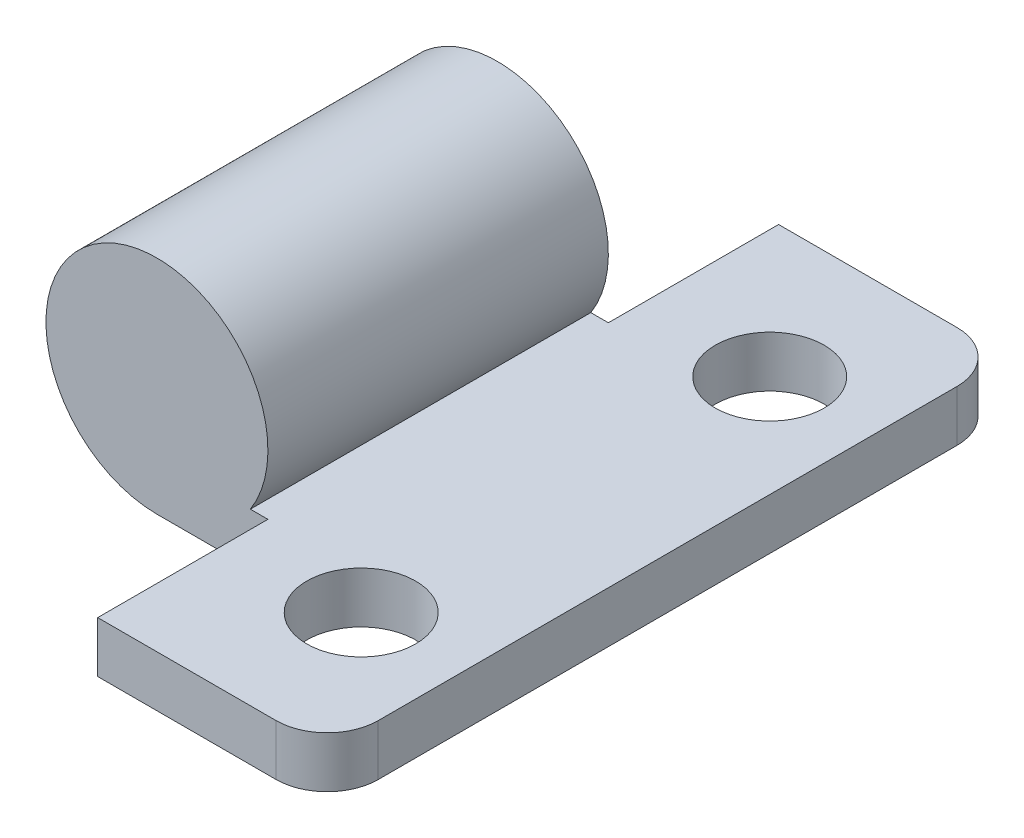
from build123d import *

# Parameters (mm, degrees)
EXTRUDE_1_DEPTH          = 10
CUT_EXTRUDE_1_DEPTH      = 16.006678513
CUT_EXTRUDE_1_DEPTH_BACK = 16.006678513
SKETCH_2_R               = 1.6
SKETCH_2_W               = 6.52
SKETCH_2_H               = 5
FILLET_1_R               = 1.5


with BuildPart() as part:
    # 草图1 → 凸台-拉伸1 (new, symmetric)
    with BuildSketch(Plane.XY):
        with BuildLine():
            Line((0, -3.26), (10, -3.26))
            Line((10, -3.26), (10, -1.76))
            Line((10, -1.76), (2.744084547, -1.76))
            ThreePointArc((2.744084547, -1.76), (-1.563649577, 2.860524427), (0, -3.26))
        make_face()
    extrude(amount=EXTRUDE_1_DEPTH, both=True)

    # 草图2 → 切除-拉伸1 (cut, two sides: drawn at the far end of the back side and taken through both)
    with BuildSketch(Plane(origin=(0, -1.76, 0), x_dir=(1, 0, 0), z_dir=(0, 1, 0)).offset(-CUT_EXTRUDE_1_DEPTH_BACK)):
        with Locations(Location((7, 6, 0), (0, 0, 180))):
            Circle(SKETCH_2_R)
        with Locations((7, -6)):
            Circle(SKETCH_2_R)
        with Locations((0, 7.5)):
            Rectangle(SKETCH_2_W, SKETCH_2_H)
        with Locations((0, -7.5)):
            Rectangle(SKETCH_2_W, SKETCH_2_H)
    extrude(amount=CUT_EXTRUDE_1_DEPTH + CUT_EXTRUDE_1_DEPTH_BACK, mode=Mode.SUBTRACT)

    # 圆角1
    fillet_1_edges = [part.edges().sort_by_distance(p)[0] for p in [
        (10, -2.51, 10),
        (10, -2.51, -10),
    ]]
    fillet(fillet_1_edges, radius=FILLET_1_R)


solid = part.part
